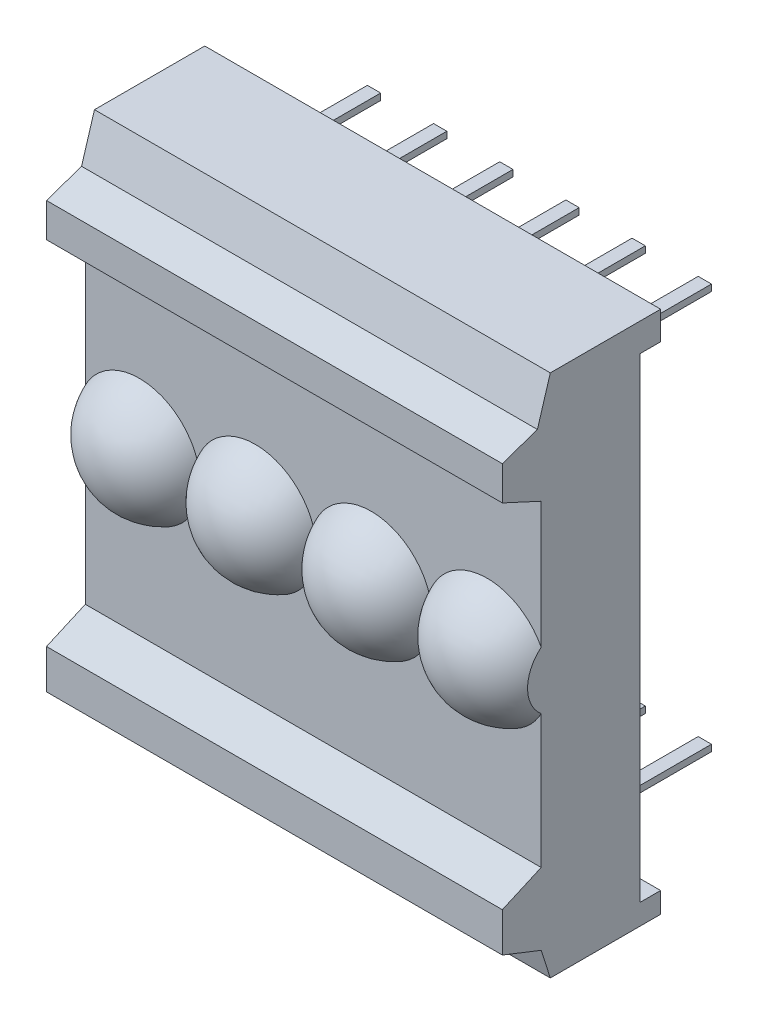
from build123d import *

# Parameters (mm, degrees)
EXTRUDE_1_DEPTH = 17.5
SKETCH_6_W      = 0.51
SKETCH_6_H      = 0.25
EXTRUDE_2_DEPTH = 4.89


with BuildPart() as part:
    # 草图2 → 凸台-拉伸1 (new body)
    with BuildSketch(Plane(origin=(0, 0, 0), x_dir=(0, 0, -1), z_dir=(1, 0, 0))):
        Polygon((-3.442512479, 20.118929979), (0.792082517, 20.118929979), (0.792082517, 19.034466272), (0, 19.034466272), (0, 0.792082517), (0.792082517, 0.792082517), (0.792082517, 0), (0, 0), (-3.442512479, 0), (-3.79285667, 1.095795152), (-5.283117125, 1.682856003), (-5.283117125, 3.191302286), (-3.79285667, 3.850153416), (-3.79285667, 16.026820243), (-5.283117125, 16.71396292), (-5.283117125, 18.019534007), (-3.937694697, 18.484803601), align=None)
    extrude(amount=EXTRUDE_1_DEPTH)

    # 草图5 → 旋转8 (revolve)
    with BuildSketch(Plane.XY.offset(2.89285667)):
        with BuildLine():
            Line((0, 10.068929979), (17.5, 10.068929979))
            Line((17.5, 10.068929979), (17.5, 11.490689909))
            ThreePointArc((17.5, 11.490689909), (15.277289221, 12.591913923), (13.2, 11.236182744))
            ThreePointArc((13.2, 11.236182744), (10.975, 12.596281432), (8.75, 11.236182744))
            ThreePointArc((8.75, 11.236182744), (6.517271028, 12.596269485), (4.292994354, 11.222403449))
            ThreePointArc((4.292994354, 11.222403449), (2.215086636, 12.56500204), (0, 11.463338455))
            Line((0, 11.463338455), (0, 10.068929979))
        make_face()
    revolve(axis=Axis((0, 10.068929979, 2.89285667), (1, 0, 0)))

    # 草图6 → 凸台-拉伸2 (add)
    with BuildSketch(Plane(origin=(0, 0, 0), x_dir=(-1, 0, 0), z_dir=(0, 0, -1))):
        with Locations((-12.56, 17.709464989)):
            Rectangle(SKETCH_6_W, SKETCH_6_H)
        with Locations((-15.1, 17.709464989)):
            Rectangle(SKETCH_6_W, SKETCH_6_H)
        with Locations((-10.02, 17.709464989)):
            Rectangle(SKETCH_6_W, SKETCH_6_H)
        with Locations((-7.48, 17.709464989)):
            Rectangle(SKETCH_6_W, SKETCH_6_H)
        with Locations((-4.94, 17.709464989)):
            Rectangle(SKETCH_6_W, SKETCH_6_H)
        with Locations((-2.4, 17.709464989)):
            Rectangle(SKETCH_6_W, SKETCH_6_H)
        with Locations((-15.1, 2.409464989)):
            Rectangle(SKETCH_6_W, SKETCH_6_H)
        with Locations((-12.56, 2.409464989)):
            Rectangle(SKETCH_6_W, SKETCH_6_H)
        with Locations((-10.02, 2.409464989)):
            Rectangle(SKETCH_6_W, SKETCH_6_H)
        with Locations((-7.48, 2.409464989)):
            Rectangle(SKETCH_6_W, SKETCH_6_H)
        with Locations((-4.94, 2.409464989)):
            Rectangle(SKETCH_6_W, SKETCH_6_H)
        with Locations((-2.4, 2.409464989)):
            Rectangle(SKETCH_6_W, SKETCH_6_H)
    extrude(amount=EXTRUDE_2_DEPTH)


solid = part.part
